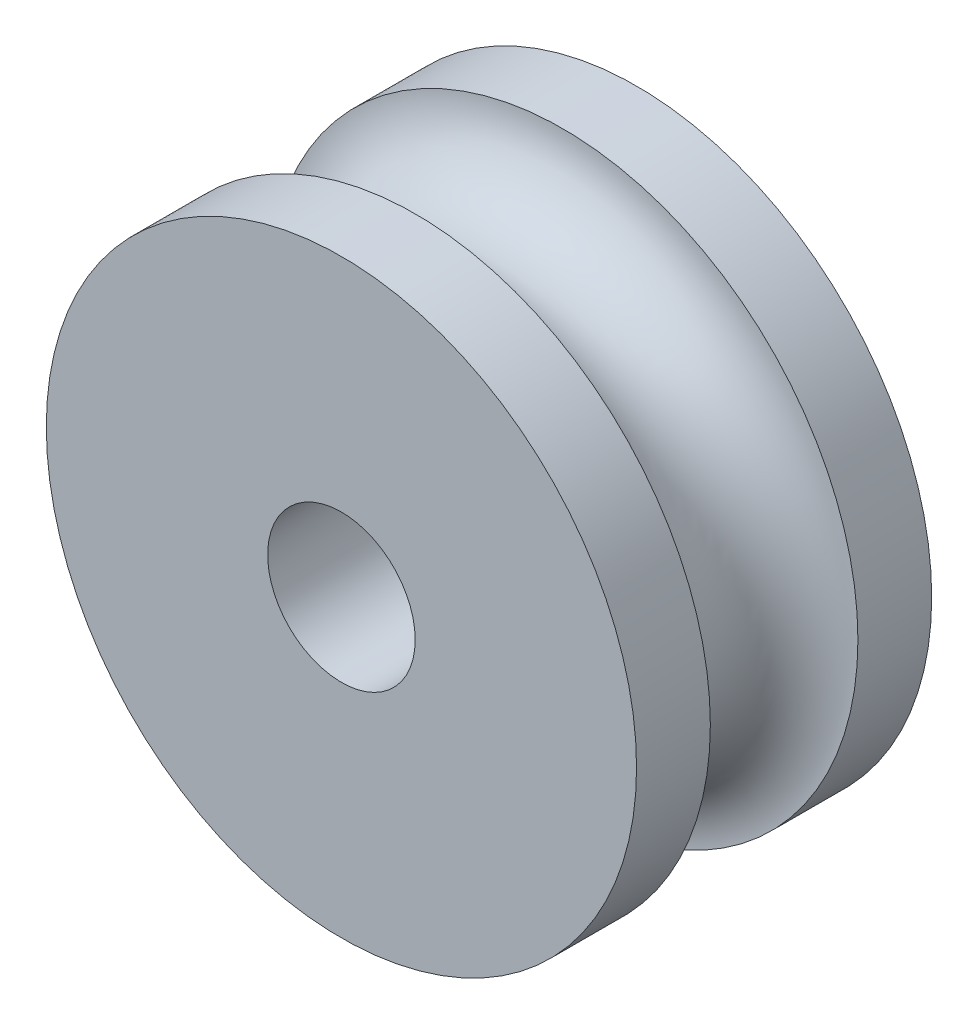
from build123d import *

# Parameters (mm, degrees)
SKETCH1_R           = 40
SKETCH1_R_2         = 10
BOSS_EXTRUDE1_DEPTH = 40
SKETCH2_R           = 10


with BuildPart() as part:
    # Sketch1 → Boss-Extrude1 (new body)
    with BuildSketch(Plane.XY):
        Circle(SKETCH1_R)
        Circle(SKETCH1_R_2, mode=Mode.SUBTRACT)
    extrude(amount=BOSS_EXTRUDE1_DEPTH)

    # Sketch2 → Cut-Revolve1 (revolve, cut)
    with BuildSketch(Plane(origin=(0, 0, 0), x_dir=(1, 0, 0), z_dir=(0, 1, 0))):
        with Locations((-40, -20)):
            Circle(SKETCH2_R)
    revolve(axis=Axis((0, 0, 0), (0, 0, 1)), mode=Mode.SUBTRACT)


solid = part.part
